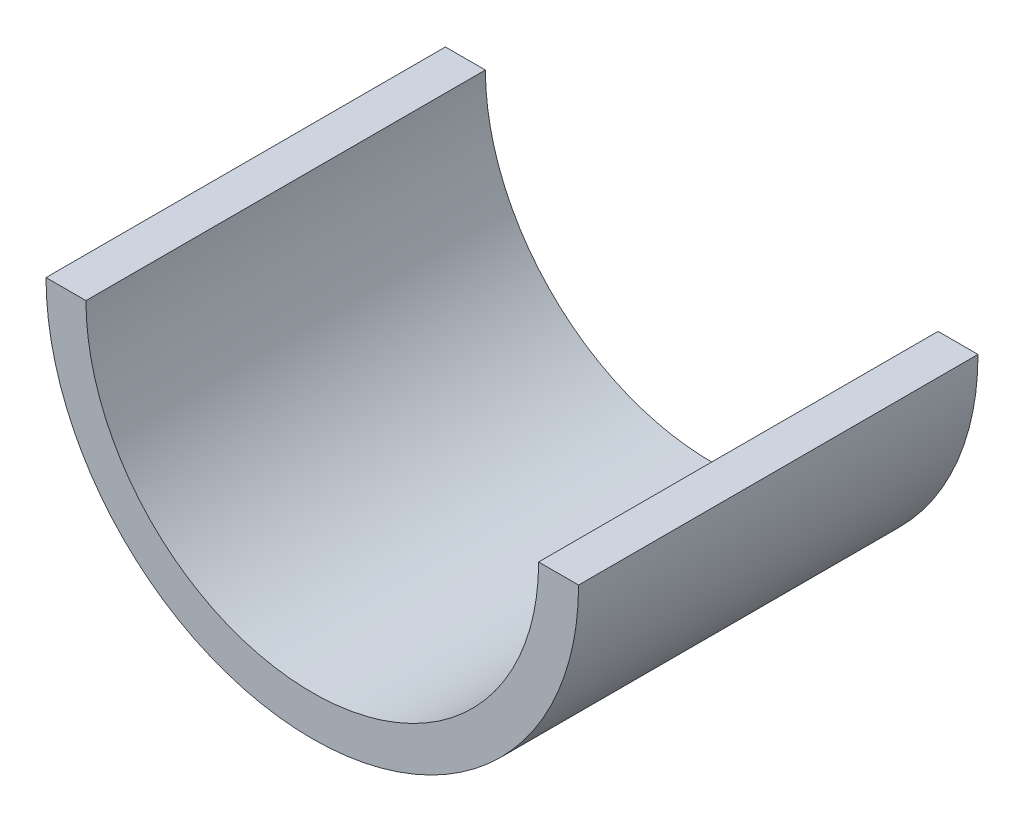
from build123d import *

# Parameters (mm, degrees)
BOSS_EXTRUDE1_DEPTH = 15


with BuildPart() as part:
    # Sketch1 → Boss-Extrude1 (new body)
    with BuildSketch(Plane.XY):
        with BuildLine():
            Line((0, 0), (1.5, 0))
            ThreePointArc((1.5, 0), (10, -8.5), (18.5, 0))
            Line((18.5, 0), (20, 0))
            ThreePointArc((20, 0), (10, -10), (0, 0))
        make_face()
    extrude(amount=BOSS_EXTRUDE1_DEPTH)


solid = part.part
